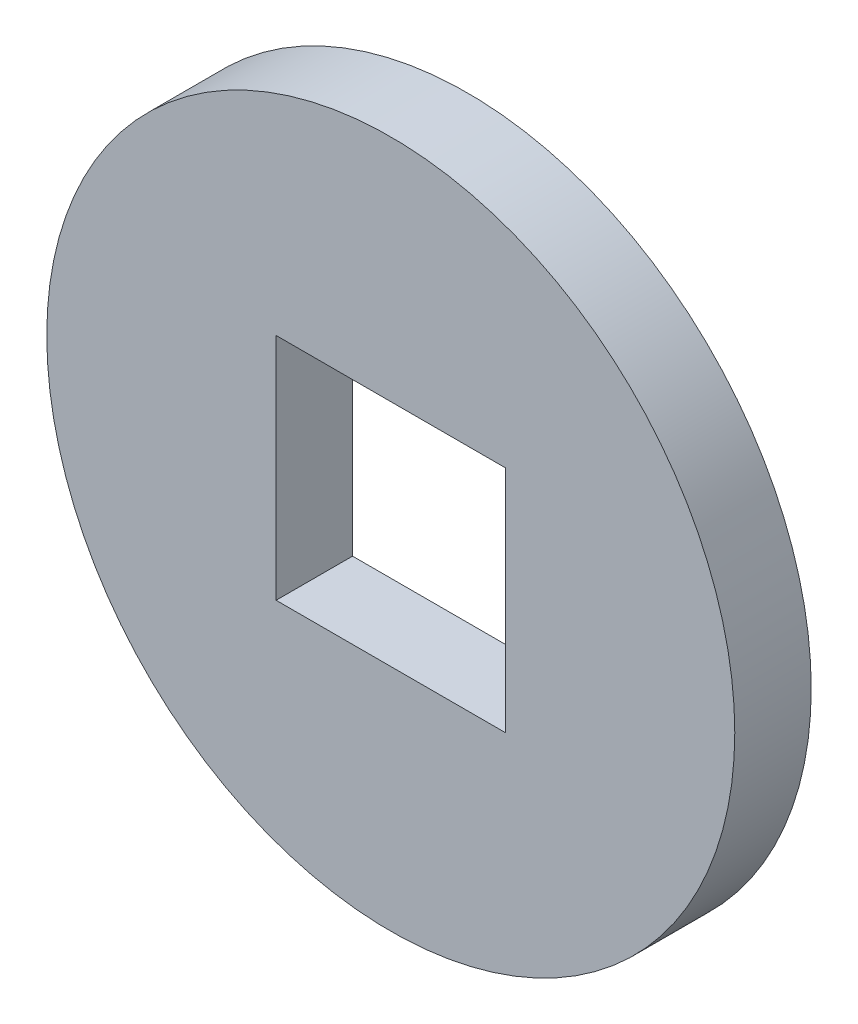
from build123d import *

# Parameters (mm, degrees)
SKETCH_1_R      = 4.5
SKETCH_1_W      = 3
SKETCH_1_H      = 3
EXTRUDE_1_DEPTH = 1


with BuildPart() as part:
    # 草图1 → 凸台-拉伸1 (new body)
    with BuildSketch(Plane.XY):
        Circle(SKETCH_1_R)
        Rectangle(SKETCH_1_W, SKETCH_1_H, mode=Mode.SUBTRACT)
    extrude(amount=EXTRUDE_1_DEPTH)


solid = part.part
